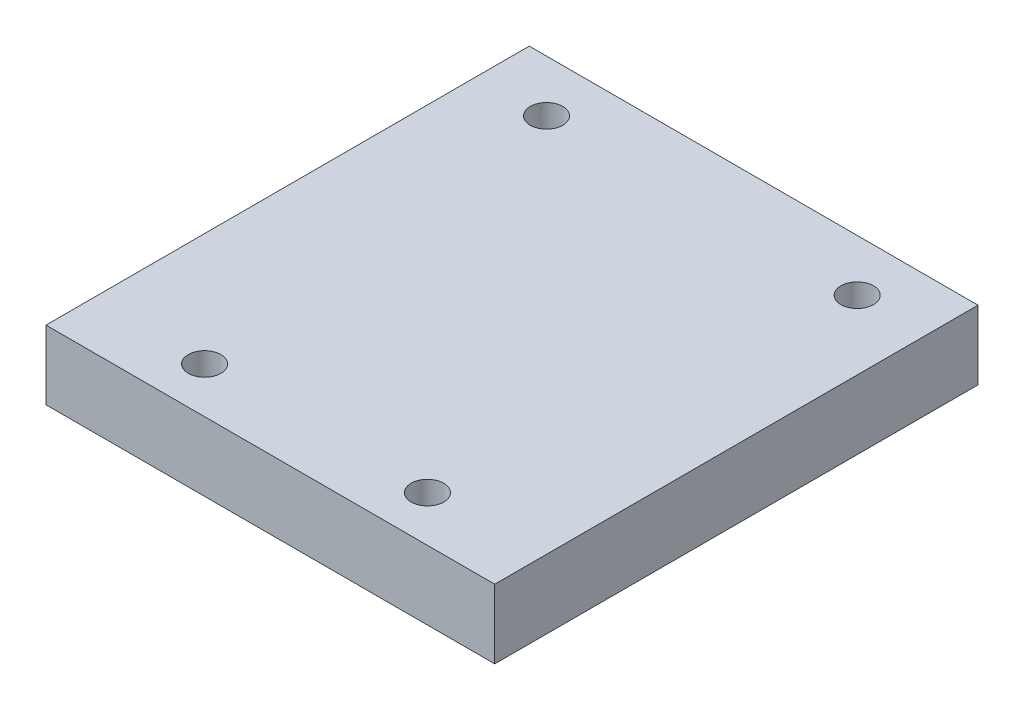
from build123d import *

# Parameters (mm, degrees)
SKETCH1_W           = 82.55
SKETCH1_H           = 88.9
BOSS_EXTRUDE1_DEPTH = 12.7
SKETCH2_R           = 3
CUT_EXTRUDE1_DEPTH  = 6.35
SKETCH3_R           = 2.75
CUT_EXTRUDE2_DEPTH  = 6.35


with BuildPart() as part:
    # Sketch1 → Boss-Extrude1 (new body)
    with BuildSketch(Plane(origin=(0, 0, 0), x_dir=(1, 0, 0), z_dir=(0, 1, 0))):
        with Locations((-41.275, -44.45)):
            Rectangle(SKETCH1_W, SKETCH1_H)
    extrude(amount=BOSS_EXTRUDE1_DEPTH)

    # Sketch2 → Cut-Extrude1 (cut)
    with BuildSketch(Plane(origin=(0, 12.7, 0), x_dir=(1, 0, 0), z_dir=(0, 1, 0))):
        with Locations((-69.85, -9.525)):
            Circle(SKETCH2_R)
        with Locations((-12.7, -9.525)):
            Circle(SKETCH2_R)
        with Locations((-61.775, -80.504650473)):
            Circle(SKETCH2_R)
        with Locations((-20.775, -80.504650473)):
            Circle(SKETCH2_R)
    extrude(amount=-CUT_EXTRUDE1_DEPTH, mode=Mode.SUBTRACT)

    # Sketch3 → Cut-Extrude2 (cut)
    with BuildSketch(Plane.XZ):
        with Locations((-50.8, 57.15)):
            Circle(SKETCH3_R)
        with Locations((-34.8, 57.15)):
            Circle(SKETCH3_R)
        with Locations((-50.8, 41.15)):
            Circle(SKETCH3_R)
        with Locations((-34.8, 41.15)):
            Circle(SKETCH3_R)
    extrude(amount=-CUT_EXTRUDE2_DEPTH, mode=Mode.SUBTRACT)


solid = part.part
